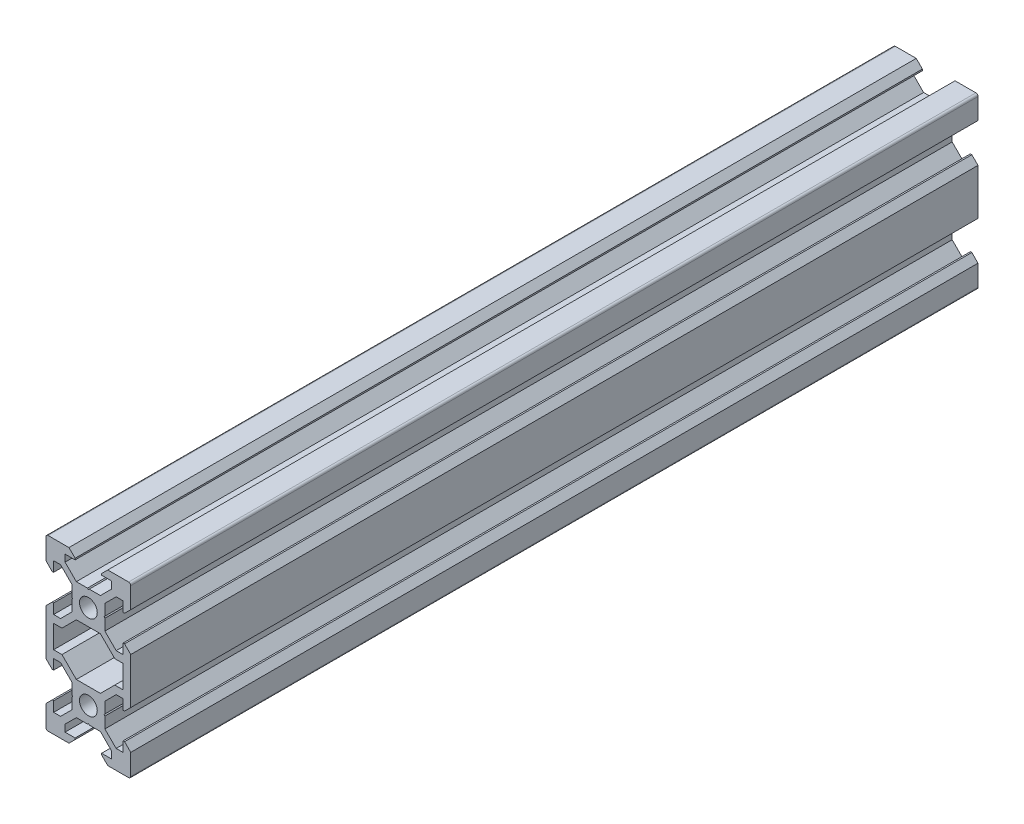
from build123d import *

# Parameters (mm, degrees)
SKETCH1_R           = 2.1
BOSS_EXTRUDE1_DEPTH = 200


with BuildPart() as part:
    # Sketch1 → Boss-Extrude1 (new body)
    with BuildSketch(Plane.XY):
        with BuildLine():
            Line((4.58, -20), (9.5, -20))
            ThreePointArc((9.5, -20), (9.853553391, -19.853553391), (10, -19.5))
            Line((10, -19.5), (10, -14.58))
            Line((10, -14.58), (8.545, -13.125))
            Line((8.545, -13.125), (8.2, -13.125))
            Line((8.2, -13.125), (8.2, -15.5))
            Line((8.2, -15.5), (6.560660172, -15.5))
            Line((6.560660172, -15.5), (3.9, -12.839339828))
            Line((3.9, -12.839339828), (3.9, -10.21))
            Line((3.9, -10.21), (3.69, -10))
            Line((3.69, -10), (3.9, -9.79))
            Line((3.9, -9.79), (3.9, -7.160660172))
            Line((3.9, -7.160660172), (6.560660172, -4.5))
            Line((6.560660172, -4.5), (8.2, -4.5))
            Line((8.2, -4.5), (8.2, -6.875))
            Line((8.2, -6.875), (8.545, -6.875))
            Line((8.545, -6.875), (10, -5.42))
            Line((10, -5.42), (10, 5.42))
            Line((10, 5.42), (8.545, 6.875))
            Line((8.545, 6.875), (8.2, 6.875))
            Line((8.2, 6.875), (8.2, 4.5))
            Line((8.2, 4.5), (6.560660172, 4.5))
            Line((6.560660172, 4.5), (3.9, 7.160660172))
            Line((3.9, 7.160660172), (3.9, 9.79))
            Line((3.9, 9.79), (3.69, 10))
            Line((3.69, 10), (3.9, 10.21))
            Line((3.9, 10.21), (3.9, 12.839339828))
            Line((3.9, 12.839339828), (6.560660172, 15.5))
            Line((6.560660172, 15.5), (8.2, 15.5))
            Line((8.2, 15.5), (8.2, 13.125))
            Line((8.2, 13.125), (8.545, 13.125))
            Line((8.545, 13.125), (10, 14.58))
            Line((10, 14.58), (10, 19.5))
            ThreePointArc((10, 19.5), (9.853553391, 19.853553391), (9.5, 20))
            Line((9.5, 20), (4.58, 20))
            Line((4.58, 20), (3.125, 18.545))
            Line((3.125, 18.545), (3.125, 18.2))
            Line((3.125, 18.2), (5.5, 18.2))
            Line((5.5, 18.2), (5.5, 16.560660172))
            Line((5.5, 16.560660172), (2.839339828, 13.9))
            Line((2.839339828, 13.9), (0.21, 13.9))
            Line((0.21, 13.9), (0, 13.69))
            Line((0, 13.69), (-0.21, 13.9))
            Line((-0.21, 13.9), (-2.839339828, 13.9))
            Line((-2.839339828, 13.9), (-5.5, 16.560660172))
            Line((-5.5, 16.560660172), (-5.5, 18.2))
            Line((-5.5, 18.2), (-3.125, 18.2))
            Line((-3.125, 18.2), (-3.125, 18.545))
            Line((-3.125, 18.545), (-4.58, 20))
            Line((-4.58, 20), (-9.5, 20))
            ThreePointArc((-9.5, 20), (-9.853553391, 19.853553391), (-10, 19.5))
            Line((-10, 19.5), (-10, 14.58))
            Line((-10, 14.58), (-8.545, 13.125))
            Line((-8.545, 13.125), (-8.2, 13.125))
            Line((-8.2, 13.125), (-8.2, 15.5))
            Line((-8.2, 15.5), (-6.560660172, 15.5))
            Line((-6.560660172, 15.5), (-3.9, 12.839339828))
            Line((-3.9, 12.839339828), (-3.9, 10.21))
            Line((-3.9, 10.21), (-3.69, 10))
            Line((-3.69, 10), (-3.9, 9.79))
            Line((-3.9, 9.79), (-3.9, 7.160660172))
            Line((-3.9, 7.160660172), (-6.560660172, 4.5))
            Line((-6.560660172, 4.5), (-8.2, 4.5))
            Line((-8.2, 4.5), (-8.2, 6.875))
            Line((-8.2, 6.875), (-8.545, 6.875))
            Line((-8.545, 6.875), (-10, 5.42))
            Line((-10, 5.42), (-10, -5.42))
            Line((-10, -5.42), (-8.545, -6.875))
            Line((-8.545, -6.875), (-8.2, -6.875))
            Line((-8.2, -6.875), (-8.2, -4.5))
            Line((-8.2, -4.5), (-6.560660172, -4.5))
            Line((-6.560660172, -4.5), (-3.9, -7.160660172))
            Line((-3.9, -7.160660172), (-3.9, -9.79))
            Line((-3.9, -9.79), (-3.69, -10))
            Line((-3.69, -10), (-3.9, -10.21))
            Line((-3.9, -10.21), (-3.9, -12.839339828))
            Line((-3.9, -12.839339828), (-6.560660172, -15.5))
            Line((-6.560660172, -15.5), (-8.2, -15.5))
            Line((-8.2, -15.5), (-8.2, -13.125))
            Line((-8.2, -13.125), (-8.545, -13.125))
            Line((-8.545, -13.125), (-10, -14.58))
            Line((-10, -14.58), (-10, -19.5))
            ThreePointArc((-10, -19.5), (-9.853553391, -19.853553391), (-9.5, -20))
            Line((-9.5, -20), (-4.58, -20))
            Line((-4.58, -20), (-3.125, -18.545))
            Line((-3.125, -18.545), (-3.125, -18.2))
            Line((-3.125, -18.2), (-5.5, -18.2))
            Line((-5.5, -18.2), (-5.5, -16.560660172))
            Line((-5.5, -16.560660172), (-2.839339828, -13.9))
            Line((-2.839339828, -13.9), (-0.21, -13.9))
            Line((-0.21, -13.9), (0, -13.69))
            Line((0, -13.69), (0.21, -13.9))
            Line((0.21, -13.9), (2.839339828, -13.9))
            Line((2.839339828, -13.9), (5.5, -16.560660172))
            Line((5.5, -16.560660172), (5.5, -18.2))
            Line((5.5, -18.2), (3.125, -18.2))
            Line((3.125, -18.2), (3.125, -18.545))
            Line((3.125, -18.545), (4.58, -20))
        make_face()
        with Locations((0, -10)):
            Circle(SKETCH1_R, mode=Mode.SUBTRACT)
        Polygon((-6.239339828, -2.7), (-8.2, -2.7), (-8.2, 2.7), (-6.239339828, 2.7), (-2.839339828, 6.1), (2.839339828, 6.1), (6.239339828, 2.7), (8.2, 2.7), (8.2, -2.7), (6.239339828, -2.7), (2.839339828, -6.1), (-2.839339828, -6.1), align=None, mode=Mode.SUBTRACT)
        with Locations((0, 10)):
            Circle(SKETCH1_R, mode=Mode.SUBTRACT)
    extrude(amount=BOSS_EXTRUDE1_DEPTH)


solid = part.part
